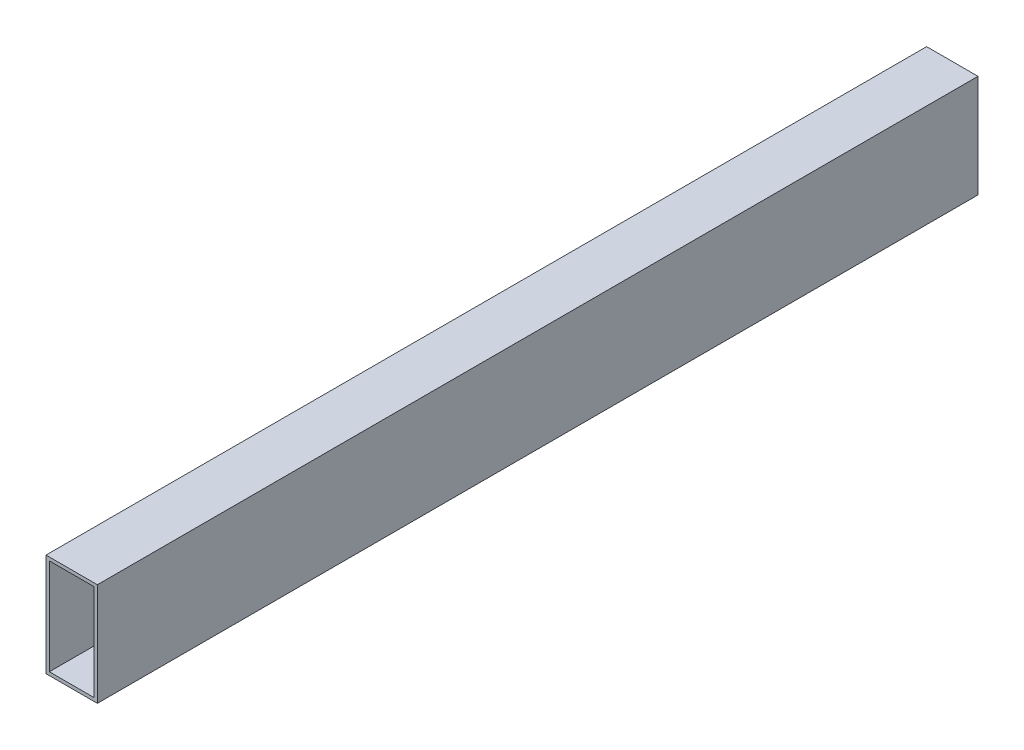
from build123d import *

# Parameters (mm, degrees)
SKETCH1_W           = 25.4
SKETCH1_H           = 50.8
BOSS_EXTRUDE1_DEPTH = 435.356
SKETCH2_W           = 22.098
SKETCH2_H           = 47.498
CUT_EXTRUDE1_DEPTH  = 440.082013825


with BuildPart() as part:
    # Sketch1 → Boss-Extrude1 (new body)
    with BuildSketch(Plane.XY):
        with Locations((-35.737209302, -4.799418605)):
            Rectangle(SKETCH1_W, SKETCH1_H)
    extrude(amount=BOSS_EXTRUDE1_DEPTH)

    # Sketch2 → Cut-Extrude1 (cut, through all)
    with BuildSketch(Plane.XY.offset(435.356)):
        with Locations((-35.737209302, -4.799418605)):
            Rectangle(SKETCH2_W, SKETCH2_H)
    extrude(amount=-CUT_EXTRUDE1_DEPTH, mode=Mode.SUBTRACT)


solid = part.part
